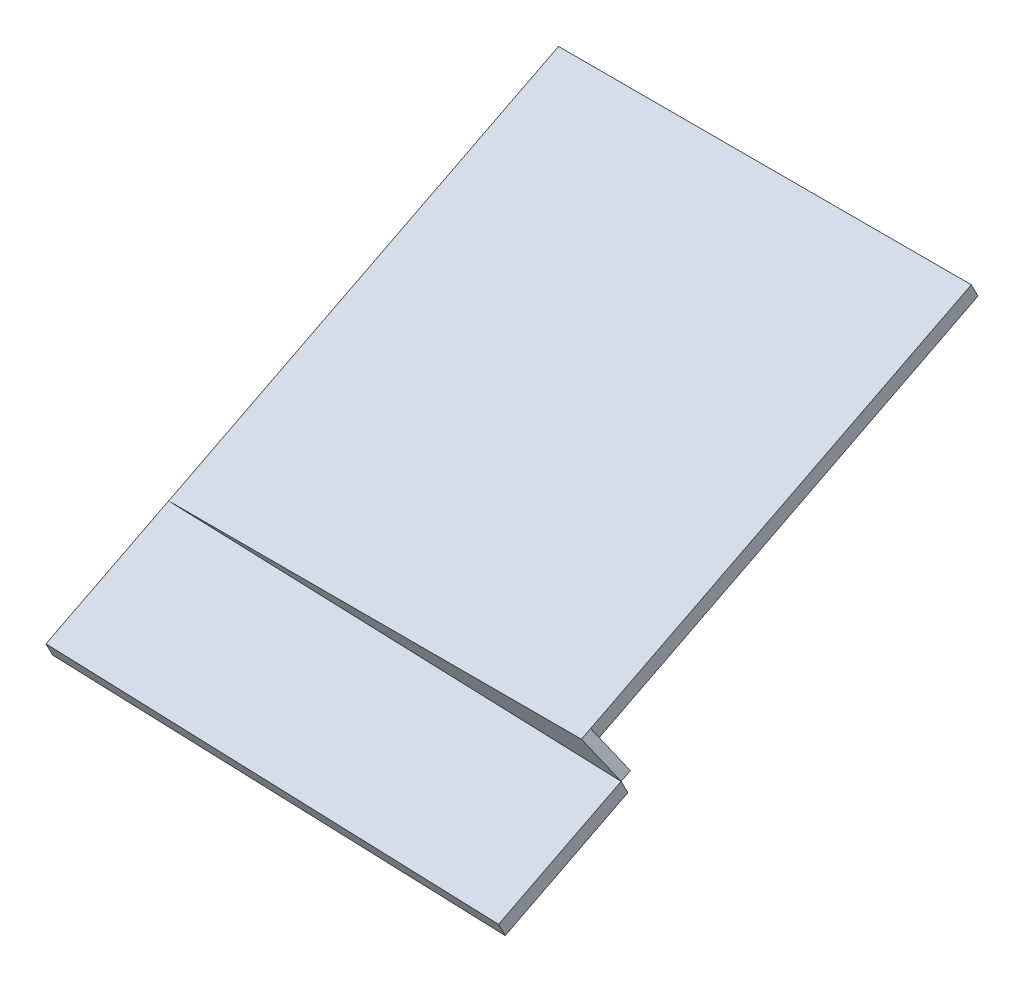
from build123d import *

# Parameters (mm, degrees)
BOSS_EXTRUDE1_DEPTH = 1200
BOSS_EXTRUDE2_DEPTH = 400
BOSS_EXTRUDE3_DEPTH = 30


with BuildPart() as part:
    # Sketch1 → Boss-Extrude1 (new body)
    with BuildSketch(Plane(origin=(0, 0, 0), x_dir=(0, 0, -1), z_dir=(1, 0, 0))):
        Polygon((0, 0), (1106.54100239, 563.810801627), (1087.155608051, 601.856780209), (-19.385394339, 38.045978583), align=None)
    extrude(amount=BOSS_EXTRUDE1_DEPTH)

    # Sketch3<3> → Boss-Extrude3 (add)
    with BuildSketch(Plane(origin=(0, -13.619714992, 26.730195726), x_dir=(1, 0, 0), z_dir=(0, -0.45399049973954797, 0.8910065241883675))):
        Polygon((556.279396443, 42.7), (0, 42.7), (1265.167266577, -67.98779329), (1200, 42.7), align=None)
    extrude(amount=-BOSS_EXTRUDE3_DEPTH)


with BuildPart() as body_2:
    # Sketch3 → Boss-Extrude2 (new body)
    with BuildSketch(Plane(origin=(0, -13.619714992, 26.730195726), x_dir=(1, 0, 0), z_dir=(0, -0.45399049973954797, 0.8910065241883675))):
        Polygon((1265.167266577, -67.98779329), (0, 42.7), (0, 0), (1265.167266577, -110.68779329), align=None)
    extrude(amount=BOSS_EXTRUDE2_DEPTH)


solid = Compound([part.part, body_2.part])
